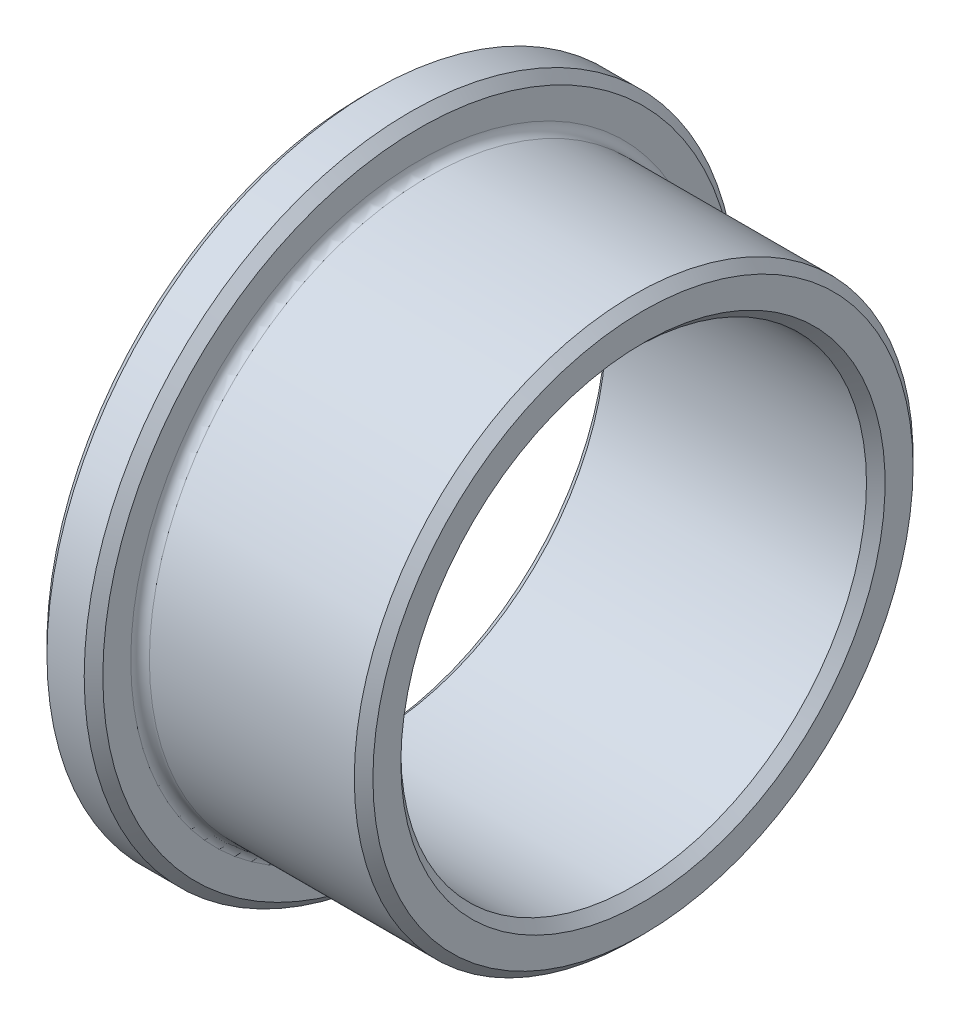
from build123d import *

# Parameters (mm, degrees)
CHAMFER1_SIZE = 1
FILLET1_R     = 1


with BuildPart() as part:
    # Sketch1 → Revolve1 (revolve)
    with BuildSketch(Plane.XY, mode=Mode.PRIVATE) as revolve1_sk:
        Polygon((0, 25), (30, 25), (30, 30), (6, 30), (6, 35), (0, 35), align=None)
    revolve(revolve1_sk.sketch.rotate(Axis((0, 0, 0), (1, 0, 0)), 90), axis=Axis((0, 0, 0), (1, 0, 0)))

    # Chamfer1
    chamfer1_edges = [part.edges().sort_by_distance(p)[0] for p in [
        (0, 0, -35),
        (6, 0, -35),
        (30, 0, -30),
        (30, 0, -25),
        (0, 0, -25),
    ]]
    chamfer(chamfer1_edges, length=CHAMFER1_SIZE)

    # Fillet1
    fillet1_edges = [part.edges().sort_by_distance(p)[0] for p in [
        (6, 0, -30),
    ]]
    fillet(fillet1_edges, radius=FILLET1_R)


solid = part.part
